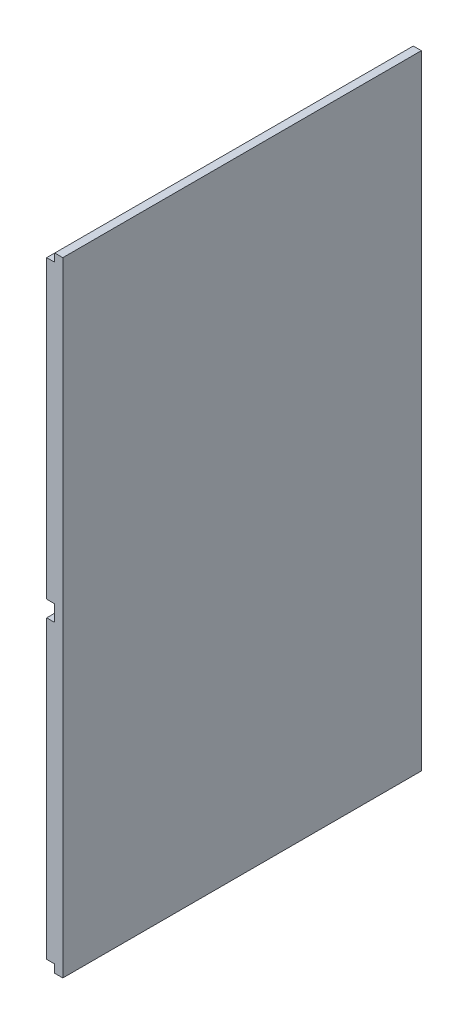
from build123d import *

# Parameters (mm, degrees)
SKETCH1_W           = 400
SKETCH1_H           = 696
BOSS_EXTRUDE1_DEPTH = 18
SKETCH2_W           = 400
SKETCH2_H           = 9
CUT_EXTRUDE1_DEPTH  = 9
SKETCH3_W           = 400
SKETCH3_H           = 18
CUT_EXTRUDE2_DEPTH  = 9


with BuildPart() as part:
    # Sketch1 → Boss-Extrude1 (new body)
    with BuildSketch(Plane(origin=(0, 0, 0), x_dir=(0, 0, -1), z_dir=(1, 0, 0))):
        Rectangle(SKETCH1_W, SKETCH1_H)
    extrude(amount=BOSS_EXTRUDE1_DEPTH)

    # Sketch2 → Cut-Extrude1 (cut)
    with BuildSketch(Plane.ZY):
        with Locations((0, -343.5)):
            Rectangle(SKETCH2_W, SKETCH2_H)
        with Locations((0, 343.5)):
            Rectangle(SKETCH2_W, SKETCH2_H)
    extrude(amount=-CUT_EXTRUDE1_DEPTH, mode=Mode.SUBTRACT)

    # Sketch3 → Cut-Extrude2 (cut)
    with BuildSketch(Plane.ZY):
        Rectangle(SKETCH3_W, SKETCH3_H)
    extrude(amount=-CUT_EXTRUDE2_DEPTH, mode=Mode.SUBTRACT)


solid = part.part
